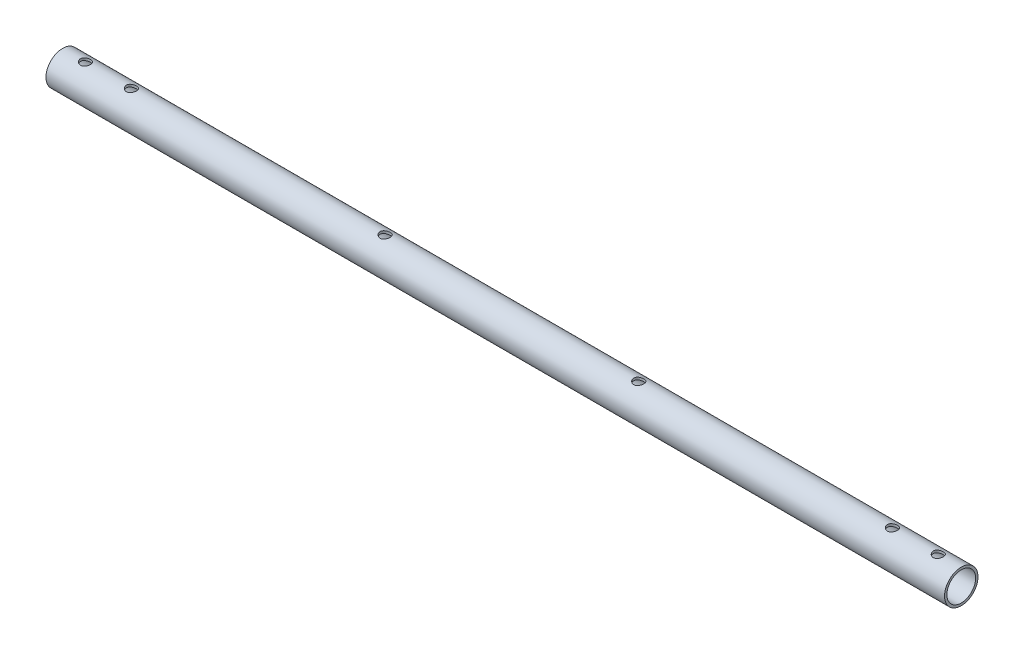
from build123d import *

# Parameters (mm, degrees)
SKETCH1_R               = 36.5
SKETCH1_R_2             = 31.34
BOSS_EXTRUDE1_DEPTH     = 1960
CUT_EXTRUDE1_DEPTH      = 1961.679601567
CUT_EXTRUDE1_DEPTH_BACK = 1961.679601567
SKETCH2_R               = 11
SKETCH3_R               = 11
CUT_EXTRUDE2_DEPTH      = 1961.67960167
LPATTERN1_COUNT         = 4
LPATTERN1_PITCH         = 553.33
CUT_EXTRUDE3_DEPTH      = 1961.67960167
CUT_EXTRUDE3_DEPTH_BACK = 1961.67960167
SKETCH4_R               = 11


with BuildPart() as part:
    # Sketch1 → Boss-Extrude1 (new body)
    with BuildSketch(Plane(origin=(0, 0, 0), x_dir=(0, 0, -1), z_dir=(1, 0, 0))):
        Circle(SKETCH1_R)
        Circle(SKETCH1_R_2, mode=Mode.SUBTRACT)
    extrude(amount=BOSS_EXTRUDE1_DEPTH)

    # Sketch2 → Cut-Extrude1 (cut, two sides: drawn at the far end of the back side and taken through both)
    with BuildSketch(Plane(origin=(0, 0, 0), x_dir=(1, 0, 0), z_dir=(0, 1, 0)).offset(-CUT_EXTRUDE1_DEPTH_BACK)):
        with Locations(Location((50, 0, 0), (0, 0, 270))):
            Circle(SKETCH2_R)
    extrude(amount=CUT_EXTRUDE1_DEPTH + CUT_EXTRUDE1_DEPTH_BACK, mode=Mode.SUBTRACT)

    # Sketch3 → Cut-Extrude2 (cut, symmetric)
    with BuildSketch(Plane(origin=(0, 0, 0), x_dir=(1, 0, 0), z_dir=(0, 1, 0))):
        with Locations(Location((150, 0, 0), (0, 0, 270))):
            Circle(SKETCH3_R)
    cut_extrude2 = extrude(amount=CUT_EXTRUDE2_DEPTH, both=True, mode=Mode.SUBTRACT)

    # LPattern1: Cut-Extrude2 ×4
    with Locations(*[(i * LPATTERN1_PITCH, 0, 0) for i in range(1, LPATTERN1_COUNT)]):
        add(cut_extrude2, mode=Mode.SUBTRACT)

    # Sketch4 → Cut-Extrude3 (cut, two sides: drawn at the far end of the back side and taken through both)
    with BuildSketch(Plane(origin=(0, 0, 0), x_dir=(1, 0, 0), z_dir=(0, 1, 0)).offset(-CUT_EXTRUDE3_DEPTH_BACK)):
        with Locations(Location((1909.99, 0, 0), (0, 0, 270))):
            Circle(SKETCH4_R)
    extrude(amount=CUT_EXTRUDE3_DEPTH + CUT_EXTRUDE3_DEPTH_BACK, mode=Mode.SUBTRACT)


solid = part.part
